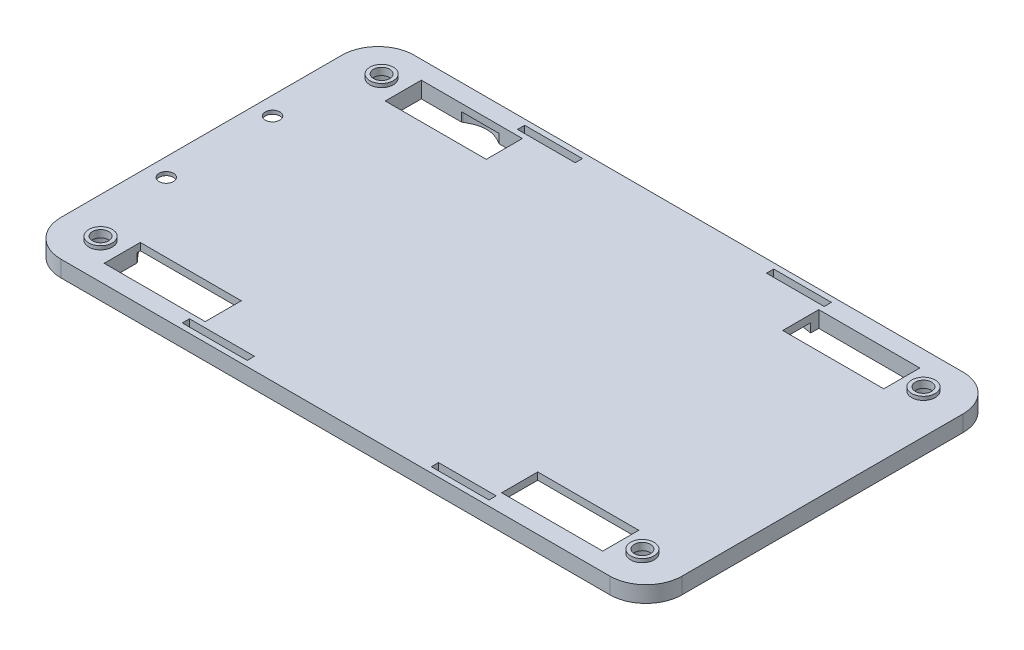
from build123d import *

# Parameters (mm, degrees)
BOSS_EXTRUDE2_DEPTH     = 5.5
CUT_EXTRUDE1_DEPTH      = 2.5
SKETCH7_W               = 15.126318285
SKETCH7_H               = 50.045217971
CUT_EXTRUDE2_DEPTH      = 2.5
SKETCH9_R               = 4.5
CUT_EXTRUDE5_DEPTH      = 3.5
SKETCH10_R              = 2.25
CUT_EXTRUDE6_DEPTH      = 21
SKETCH8_W               = 28
SKETCH8_H               = 10
CUT_EXTRUDE8_DEPTH      = 42
SKETCH8_3_W             = 12
SKETCH8_3_H             = 10
SKETCH8_3_R             = 3.5
CUT_EXTRUDE9_DEPTH      = 1
MIRROR2_COPY_1_SKETCH_R = 4.5
MIRROR2_COPY_1_DEPTH    = 3.5
MIRROR2_COPY_2_SKETCH_R = 2.25
MIRROR2_COPY_2_DEPTH    = 21
MIRROR2_COPY_3_SKETCH_W = 28
MIRROR2_COPY_3_SKETCH_H = 10
MIRROR2_COPY_3_DEPTH    = 42
MIRROR2_COPY_4_SKETCH_W = 12
MIRROR2_COPY_4_SKETCH_H = 10
MIRROR2_COPY_4_SKETCH_R = 3.5
MIRROR2_COPY_4_DEPTH    = 1
SKETCH13_W              = 122.138782423
SKETCH13_H              = 57.881417702
CUT_EXTRUDE10_DEPTH     = 1
SKETCH16_W              = 16
SKETCH16_H              = 2
SKETCH16_W_2            = 18
CUT_EXTRUDE12_DEPTH     = 57
SKETCH17_W              = 198.020150231
SKETCH17_H              = 122.239022266
CUT_EXTRUDE14_DEPTH     = 48.5
SKETCH23_R              = 2
CUT_EXTRUDE15_DEPTH     = 48.5
SKETCH23_3_R            = 4.25
SKETCH23_3_R_2          = 2
CUT_EXTRUDE16_DEPTH     = 1
SKETCH24_R              = 3.25
SKETCH24_R_2            = 2.25
BOSS_EXTRUDE3_DEPTH     = 1


with BuildPart() as part:
    # Sketch6 → Boss-Extrude2 (new body)
    with BuildSketch(Plane(origin=(0, 0, 0), x_dir=(1, 0, 0), z_dir=(0, 1, 0))):
        with BuildLine():
            Line((73.981646775, 59.583909473), (-78.157135648, 59.583909473))
            ThreePointArc((-78.157135648, 59.583909473), (-85.22820346, 56.654977285), (-88.157135648, 49.583909473))
            Line((-88.157135648, 49.583909473), (-88.157135648, -28.297508229))
            ThreePointArc((-88.157135648, -28.297508229), (-85.22820346, -35.368576041), (-78.157135648, -38.297508229))
            Line((-78.157135648, -38.297508229), (73.981646775, -38.297508229))
            ThreePointArc((73.981646775, -38.297508229), (81.052714587, -35.368576041), (83.981646775, -28.297508229))
            Line((83.981646775, -28.297508229), (83.981646775, 49.583909473))
            ThreePointArc((83.981646775, 49.583909473), (81.052714587, 56.654977285), (73.981646775, 59.583909473))
        make_face()
    extrude(amount=BOSS_EXTRUDE2_DEPTH)

    # Sketch1 → Cut-Extrude1 (cut)
    with BuildSketch(Plane(origin=(0, 0, 0), x_dir=(1, 0, 0), z_dir=(0, 1, 0))):
        with BuildLine():
            Line((77.806365081, -0.96565382), (-77.157134057, -0.96565382))
            Line((-77.157134057, -0.96565382), (-77.157133487, -14.112200011))
            add(Edge.make_bspline(
                [(-77.157133487, -14.112200011), (-77.156536942, -14.370123486), (-77.109197781, -14.873209632), (-76.835922488, -15.955912897), (-76.187889009, -17.500769448), (-75.043983016, -19.418277882), (-73.152039277, -22.009216703), (-70.349522729, -25.082160357), (-66.873619377, -28.097169115), (-63.686430755, -30.214139025), (-61.001852204, -31.406236435), (-58.827378352, -31.848010778), (-57.571800044, -31.879365283), (-56.919048161, -31.916770504)],
                knots=[0.000484301, 0.000484301, 0.000484301, 0.000484301, 0.031521334, 0.062558366, 0.124632431, 0.186706496, 0.248780561, 0.37292869, 0.49707682, 0.62122495, 0.745373079, 0.869521209, 0.993669339, 0.993669339, 0.993669339, 0.993669339], degree=3))
            add(Edge.make_bspline(
                [(-56.919048161, -31.916770504), (-56.676855651, -31.887329504), (-56.202107187, -31.827411173), (-55.17909933, -31.687000892), (-53.829380758, -31.487736495), (-52.075898695, -31.218386946), (-49.57440565, -30.835368063), (-46.14645809, -30.337211074), (-41.582465958, -29.781294531), (-36.59758114, -29.326101352), (-29.427370913, -28.913030471), (-19.557102597, -28.846779859), (-6.483877393, -29.587535165), (5.244808229, -30.786505775), (15.023020088, -31.929485511), (22.521025078, -32.809036887), (30.153844065, -33.641998773), (35.340846207, -34.107490241), (37.926285135, -34.298975741)],
                knots=[0.000538145, 0.000538145, 0.000538145, 0.000538145, 0.016151963, 0.031765781, 0.062993416, 0.094221052, 0.125448688, 0.18790396, 0.250359232, 0.312814503, 0.375269775, 0.500180319, 0.625090862, 0.750001406, 0.812456678, 0.874911949, 0.937367221, 0.999822493, 0.999822493, 0.999822493, 0.999822493], degree=3))
            ThreePointArc((37.926285135, -34.298975741), (38.702526051, -34.294429262), (39.475271872, -34.220710033))
            add(Edge.make_bspline(
                [(39.475271872, -34.220710033), (41.007855914, -34.057436076), (44.089984585, -33.714701696), (50.083540013, -32.842915348), (57.096899249, -31.185924421), (64.218389099, -27.883874428), (69.776327895, -23.185685517), (73.049743993, -18.278857828), (74.917700916, -14.026885359), (75.980532113, -10.773207259), (76.750872111, -7.572378035), (77.199527425, -5.064024493), (77.479780782, -3.227934), (77.653952405, -2.012317888), (77.758523252, -1.282417326), (77.806365081, -0.96565382)],
                knots=[-0.000308659, -0.000308659, -0.000308659, -0.000308659, 0.063093373, 0.126495404, 0.253299468, 0.380103532, 0.506907596, 0.633711659, 0.697113691, 0.760515723, 0.823917755, 0.887319787, 0.919020803, 0.950721818, 0.978851886, 0.978851886, 0.978851886, 0.978851886], degree=3))
        make_face()
        with BuildLine():
            Line((-77.157135648, 35.76464303), (-77.157134057, -0.96565382))
            Line((-77.157134057, -0.96565382), (77.806365081, -0.96565382))
            add(Edge.make_bspline(
                [(77.806365081, -0.96565382), (77.812438323, -0.925442533), (77.87221605, -0.53245946), (77.930059012, -0.183407073), (77.984899751, 0.147711222)],
                knots=[0.978851886, 0.978851886, 0.978851886, 0.978851886, 0.982422834, 1.01412385, 1.01412385, 1.01412385, 1.01412385], degree=3))
            add(Edge.make_bspline(
                [(77.984899751, 0.147711222), (78.028632075, 1.263321996), (78.063685274, 3.522430751), (77.942610131, 6.756968322), (77.659550444, 9.90467033), (77.073307047, 13.967118446), (75.962568899, 18.783585703), (73.443316656, 25.935742417), (69.020568834, 33.80984715), (62.049489108, 41.493231365), (53.789484117, 47.344418041), (44.612113932, 51.294661515), (34.903628635, 53.280392725), (28.311253849, 53.235690332), (25.060177828, 52.873239487)],
                knots=[0.000169226, 0.000169226, 0.000169226, 0.000169226, 0.031413574, 0.062657922, 0.09390227, 0.125146618, 0.187635314, 0.25012401, 0.375101401, 0.500078793, 0.625056185, 0.750033577, 0.875010969, 0.999988361, 0.999988361, 0.999988361, 0.999988361], degree=3))
            add(Edge.make_bspline(
                [(25.060177828, 52.873239487), (19.895446944, 51.629390577), (12.322434608, 49.13169364), (2.160698602, 45.971278142), (-3.037110446, 44.691336857), (-5.659268145, 44.190364293)],
                knots=[0.000658959, 0.000658959, 0.000658959, 0.000658959, 0.498067368, 0.746771573, 0.995475778, 0.995475778, 0.995475778, 0.995475778], degree=3))
            add(Edge.make_bspline(
                [(-5.659268145, 44.190364293), (-6.687899132, 44.046149587), (-8.728734339, 43.771857825), (-12.963271971, 43.266800577), (-18.182613839, 42.795189919), (-23.901458121, 42.63215561), (-28.830638135, 42.989857068), (-32.966568973, 43.951399156), (-35.917714049, 45.291439085), (-38.19591431, 46.677930402), (-39.939161114, 47.865789175), (-41.506959745, 48.979842665), (-42.863802202, 49.929184347), (-43.616290768, 50.440510486), (-43.98532936, 50.688555671)],
                knots=[-0.00019559, -0.00019559, -0.00019559, -0.00019559, 0.062587211, 0.125370012, 0.250935613, 0.376501215, 0.502066816, 0.627632417, 0.753198019, 0.81598082, 0.87876362, 0.941546421, 0.972937821, 1.004329222, 1.004329222, 1.004329222, 1.004329222], degree=3))
            add(Edge.make_bspline(
                [(-43.98532936, 50.688555671), (-44.244485854, 50.867312015), (-44.768150418, 51.232519494), (-45.750657054, 51.933111662), (-46.891239492, 52.75905139), (-48.145972585, 53.649626958), (-49.697116091, 54.681113287), (-51.460780236, 55.648746777), (-53.407719169, 56.259273829), (-55.251731489, 56.357375065), (-56.710973324, 56.08081223), (-57.794758617, 55.713765742), (-58.546542767, 55.391458897), (-59.229896481, 55.042763399), (-59.583745645, 54.835934013), (-59.770155285, 54.723823826)],
                knots=[-0.002497219, -0.002497219, -0.002497219, -0.002497219, 0.029065652, 0.060628523, 0.123754265, 0.186880007, 0.250005749, 0.376257234, 0.502508718, 0.628760202, 0.755011687, 0.818137429, 0.881263171, 0.944388913, 1.007514655, 1.007514655, 1.007514655, 1.007514655], degree=3))
            add(Edge.make_bspline(
                [(-59.770155285, 54.723823826), (-60.193626174, 54.476092852), (-61.03864602, 53.961192652), (-62.636768194, 52.907176262), (-65.258656407, 50.976312285), (-68.51709364, 48.049765778), (-71.244275363, 45.065662035), (-73.189921829, 42.724657875), (-74.069794154, 41.617885903), (-74.515784144, 41.052117052)],
                knots=[0.000174078, 0.000174078, 0.000174078, 0.000174078, 0.062881444, 0.12558881, 0.251003541, 0.501833004, 0.752662466, 0.878077198, 1.003491929, 1.003491929, 1.003491929, 1.003491929], degree=3))
            add(Edge.make_bspline(
                [(-74.515784144, 41.052117052), (-75.065753244, 40.22169422), (-76.07645723, 38.477870595), (-76.833603448, 36.687528936), (-77.157135648, 35.76464303)],
                knots=[0.499549048, 0.499549048, 0.499549048, 0.499549048, 0.499765799, 0.49998255, 0.49998255, 0.49998255, 0.49998255], degree=3))
        make_face()
    extrude(amount=CUT_EXTRUDE1_DEPTH, mode=Mode.SUBTRACT)

    # Sketch7 → Cut-Extrude2 (cut)
    with BuildSketch(Plane.XZ):
        with Locations((-83.782077592, -10.91040897)):
            Rectangle(SKETCH7_W, SKETCH7_H)
    extrude(amount=-CUT_EXTRUDE2_DEPTH, mode=Mode.SUBTRACT)

    # Sketch9 → Cut-Extrude5 (cut)
    with BuildSketch(Plane.XZ):
        with Locations(Location((72.981646775, -49.583909473, 0), (0, 0, 270))):
            Circle(SKETCH9_R)
    cut_extrude5 = extrude(amount=-CUT_EXTRUDE5_DEPTH, mode=Mode.SUBTRACT)

    # Sketch10 → Cut-Extrude6 (cut)
    with BuildSketch(Plane.XZ.offset(-3.5)):
        with Locations(Location((72.981646775, -49.583909473, 0), (0, 0, 270))):
            Circle(SKETCH10_R)
    cut_extrude6 = extrude(amount=-CUT_EXTRUDE6_DEPTH, mode=Mode.SUBTRACT)

    # Sketch8 → Cut-Extrude8 (cut)
    with BuildSketch(Plane(origin=(0, 5.5, 0), x_dir=(1, 0, 0), z_dir=(0, 1, 0))):
        with Locations((52.981646775, 49.583909473)):
            Rectangle(SKETCH8_W, SKETCH8_H)
    cut_extrude8 = extrude(amount=-CUT_EXTRUDE8_DEPTH, mode=Mode.SUBTRACT)

    # Sketch8<3> → Cut-Extrude9 (cut)
    with BuildSketch(Plane(origin=(0, 5.5, 0), x_dir=(1, 0, 0), z_dir=(0, 1, 0))):
        with Locations((72.981646775, 49.583909473)):
            Rectangle(SKETCH8_3_W, SKETCH8_3_H)
        with Locations(Location((72.981646775, 49.583909473, 0), (0, 0, 270))):
            Circle(SKETCH8_3_R, mode=Mode.SUBTRACT)
    cut_extrude9 = extrude(amount=-CUT_EXTRUDE9_DEPTH, mode=Mode.SUBTRACT)

    # Mirror1: Cut-Extrude5, Cut-Extrude6, Cut-Extrude8, Cut-Extrude9 across plane
    add(cut_extrude5.mirror(Plane.XY.offset(-10.643200622)), mode=Mode.SUBTRACT)
    add(cut_extrude6.mirror(Plane.XY.offset(-10.643200622)), mode=Mode.SUBTRACT)
    add(cut_extrude8.mirror(Plane.XY.offset(-10.643200622)), mode=Mode.SUBTRACT)
    add(cut_extrude9.mirror(Plane.XY.offset(-10.643200622)), mode=Mode.SUBTRACT)

    # Mirror2: Cut-Extrude5, Cut-Extrude6, Cut-Extrude8, Cut-Extrude9 across plane
    add(cut_extrude5.mirror(Plane.ZY.offset(2.087744437)), mode=Mode.SUBTRACT)
    add(cut_extrude6.mirror(Plane.ZY.offset(2.087744437)), mode=Mode.SUBTRACT)
    add(cut_extrude8.mirror(Plane.ZY.offset(2.087744437)), mode=Mode.SUBTRACT)
    add(cut_extrude9.mirror(Plane.ZY.offset(2.087744437)), mode=Mode.SUBTRACT)

    # Mirror2 copy 1 sketch → Mirror2 copy 1 (cut)
    with BuildSketch(Plane(origin=(-4.175488873, 0, -21.286401244), x_dir=(-1, 0, 0), z_dir=(0, -1, 0))):
        with Locations(Location((72.981646775, -49.583909473, 0), (0, 0, 270))):
            Circle(MIRROR2_COPY_1_SKETCH_R)
    extrude(amount=-MIRROR2_COPY_1_DEPTH, mode=Mode.SUBTRACT)

    # Mirror2 copy 2 sketch → Mirror2 copy 2 (cut)
    with BuildSketch(Plane(origin=(-4.175488873, 3.5, -21.286401244), x_dir=(-1, 0, 0), z_dir=(0, -1, 0))):
        with Locations(Location((72.981646775, -49.583909473, 0), (0, 0, 270))):
            Circle(MIRROR2_COPY_2_SKETCH_R)
    extrude(amount=-MIRROR2_COPY_2_DEPTH, mode=Mode.SUBTRACT)

    # Mirror2 copy 3 sketch → Mirror2 copy 3 (cut)
    with BuildSketch(Plane(origin=(-4.175488873, 5.5, -21.286401244), x_dir=(-1, 0, 0), z_dir=(0, 1, 0))):
        with Locations((52.981646775, 49.583909473)):
            Rectangle(MIRROR2_COPY_3_SKETCH_W, MIRROR2_COPY_3_SKETCH_H)
    extrude(amount=-MIRROR2_COPY_3_DEPTH, mode=Mode.SUBTRACT)

    # Mirror2 copy 4 sketch → Mirror2 copy 4 (cut)
    with BuildSketch(Plane(origin=(-4.175488873, 5.5, -21.286401244), x_dir=(-1, 0, 0), z_dir=(0, 1, 0))):
        with Locations((72.981646775, 49.583909473)):
            Rectangle(MIRROR2_COPY_4_SKETCH_W, MIRROR2_COPY_4_SKETCH_H)
        with Locations(Location((72.981646775, 49.583909473, 0), (0, 0, 270))):
            Circle(MIRROR2_COPY_4_SKETCH_R, mode=Mode.SUBTRACT)
    extrude(amount=-MIRROR2_COPY_4_DEPTH, mode=Mode.SUBTRACT)

    # Sketch13 → Cut-Extrude10 (cut)
    with BuildSketch(Plane(origin=(0, 5.5, 0), x_dir=(1, 0, 0), z_dir=(0, 1, 0))):
        with Locations((-2.087744436, 10.643200622)):
            Rectangle(SKETCH13_W, SKETCH13_H)
    extrude(amount=-CUT_EXTRUDE10_DEPTH, mode=Mode.SUBTRACT)

    # Sketch16 → Cut-Extrude12 (cut)
    with BuildSketch(Plane.XZ):
        with Locations((30.981646775, -57.083909473)):
            Rectangle(SKETCH16_W, SKETCH16_H)
        with Locations((30.981646775, 35.797508229)):
            Rectangle(SKETCH16_W, SKETCH16_H)
        with Locations((-38.018353225, -57.083909473)):
            Rectangle(SKETCH16_W, SKETCH16_H)
        with Locations((-37.018353225, 35.797508229)):
            Rectangle(SKETCH16_W_2, SKETCH16_H)
    extrude(amount=-CUT_EXTRUDE12_DEPTH, mode=Mode.SUBTRACT)

    # Sketch17 → Cut-Extrude14 (cut)
    with BuildSketch(Plane(origin=(0, 4.5, 0), x_dir=(1, 0, 0), z_dir=(0, 1, 0))):
        with Locations((-0.586253557, 7.90518784)):
            Rectangle(SKETCH17_W, SKETCH17_H)
    extrude(amount=CUT_EXTRUDE14_DEPTH, mode=Mode.SUBTRACT)

    # Sketch23 → Cut-Extrude15 (cut)
    with BuildSketch(Plane.XZ.offset(-2.5)):
        with Locations(Location((-83.157135648, 4.08959103, 0), (0, 0, 270))):
            Circle(SKETCH23_R)
    cut_extrude15 = extrude(amount=-CUT_EXTRUDE15_DEPTH, mode=Mode.SUBTRACT)

    # Sketch23<3> → Cut-Extrude16 (cut)
    with BuildSketch(Plane.XZ.offset(-2.5)):
        with Locations(Location((-83.157135648, 4.08959103, 0), (0, 0, 270))):
            Circle(SKETCH23_3_R)
        with Locations(Location((-83.157135648, 4.08959103, 0), (0, 0, 270))):
            Circle(SKETCH23_3_R_2, mode=Mode.SUBTRACT)
    cut_extrude16 = extrude(amount=-CUT_EXTRUDE16_DEPTH, mode=Mode.SUBTRACT)

    # Mirror4: Cut-Extrude15, Cut-Extrude16 across plane
    add(cut_extrude15.mirror(Plane.XY.offset(-10.643200622)), mode=Mode.SUBTRACT)
    add(cut_extrude16.mirror(Plane.XY.offset(-10.643200622)), mode=Mode.SUBTRACT)

    # Sketch24 → Boss-Extrude3 (add)
    # profile 1 of 4: a face of its own
    with BuildSketch(Plane(origin=(0, 4.5, 0), x_dir=(1, 0, 0), z_dir=(0, 1, 0))):
        with Locations(Location((-77.157135648, 49.583909473, 0), (0, 0, 270))):
            Circle(SKETCH24_R)
        with Locations(Location((-77.157135648, 49.583909473, 0), (0, 0, 90))):
            Circle(SKETCH24_R_2, mode=Mode.SUBTRACT)
    # profile 2 of 4: a face of its own
    with BuildSketch(Plane(origin=(0, 4.5, 0), x_dir=(1, 0, 0), z_dir=(0, 1, 0))):
        with Locations(Location((72.981646775, 49.583909473, 0), (0, 0, 270))):
            Circle(SKETCH24_R)
        with Locations(Location((72.981646775, 49.583909473, 0), (0, 0, 90))):
            Circle(SKETCH24_R_2, mode=Mode.SUBTRACT)
    # profile 3 of 4: a face of its own
    with BuildSketch(Plane(origin=(0, 4.5, 0), x_dir=(1, 0, 0), z_dir=(0, 1, 0))):
        with Locations(Location((-77.157135648, -28.297508229, 0), (0, 0, 270))):
            Circle(SKETCH24_R)
        with Locations(Location((-77.157135648, -28.297508229, 0), (0, 0, 270))):
            Circle(SKETCH24_R_2, mode=Mode.SUBTRACT)
    # profile 4 of 4: a face of its own
    with BuildSketch(Plane(origin=(0, 4.5, 0), x_dir=(1, 0, 0), z_dir=(0, 1, 0))):
        with Locations(Location((72.981646775, -28.297508229, 0), (0, 0, 270))):
            Circle(SKETCH24_R)
        with Locations(Location((72.981646775, -28.297508229, 0), (0, 0, 270))):
            Circle(SKETCH24_R_2, mode=Mode.SUBTRACT)
    extrude(amount=BOSS_EXTRUDE3_DEPTH)


solid = part.part
